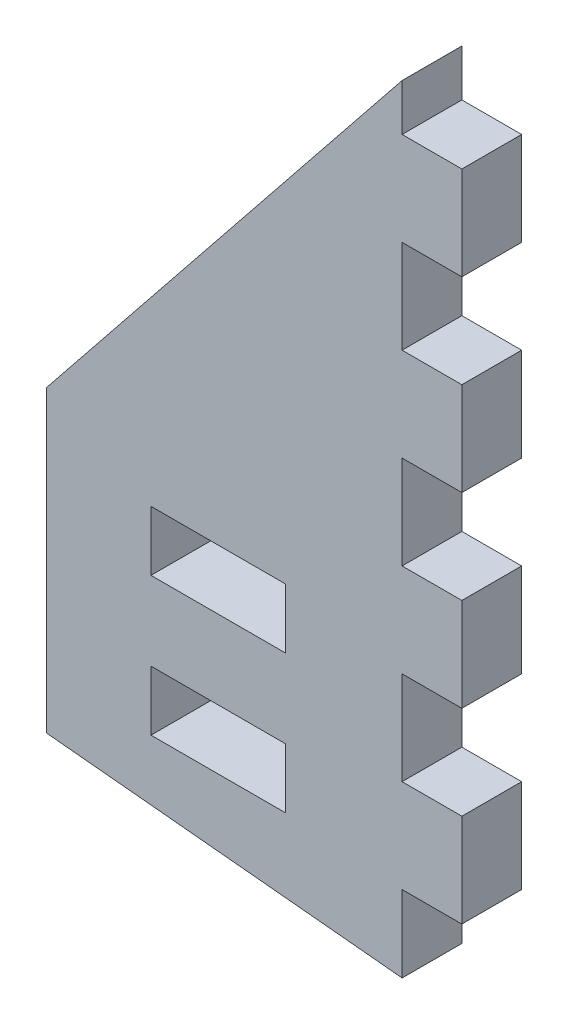
from build123d import *

# Parameters (mm, degrees)
SCHIZZO1_W                   = 9
SCHIZZO1_H                   = 4
ESTRUSIONE_ESTRUSIONE1_DEPTH = 4
SCHIZZO2_W                   = 4
SCHIZZO2_H                   = 6.25
ESTRUSIONE_ESTRUSIONE2_DEPTH = 4
RIPETIZIONE_A_L1_COUNT       = 4
RIPETIZIONE_A_L1_PITCH       = 12.5


with BuildPart() as part:
    # Schizzo1 → Estrusione-Estrusione1 (new body)
    with BuildSketch(Plane.XY):
        Polygon((0, 50), (-23.8, 20.3), (-23.8, 0.3), (0, -2), align=None)
        with Locations((-12.3, 5.67)):
            Rectangle(SCHIZZO1_W, SCHIZZO1_H, mode=Mode.SUBTRACT)
        with Locations((-12.3, 14.93)):
            Rectangle(SCHIZZO1_W, SCHIZZO1_H, mode=Mode.SUBTRACT)
    extrude(amount=ESTRUSIONE_ESTRUSIONE1_DEPTH)

    # Schizzo2 → Estrusione-Estrusione2 (add)
    with BuildSketch(Plane.XY.offset(4)):
        with Locations((2, 43.75)):
            Rectangle(SCHIZZO2_W, SCHIZZO2_H)
    estrusione_estrusione2 = extrude(amount=-ESTRUSIONE_ESTRUSIONE2_DEPTH)

    # Ripetizione a L1: Estrusione-Estrusione2 ×4
    with Locations(*[(0, -i * RIPETIZIONE_A_L1_PITCH, 0) for i in range(1, RIPETIZIONE_A_L1_COUNT)]):
        add(estrusione_estrusione2)


solid = part.part
